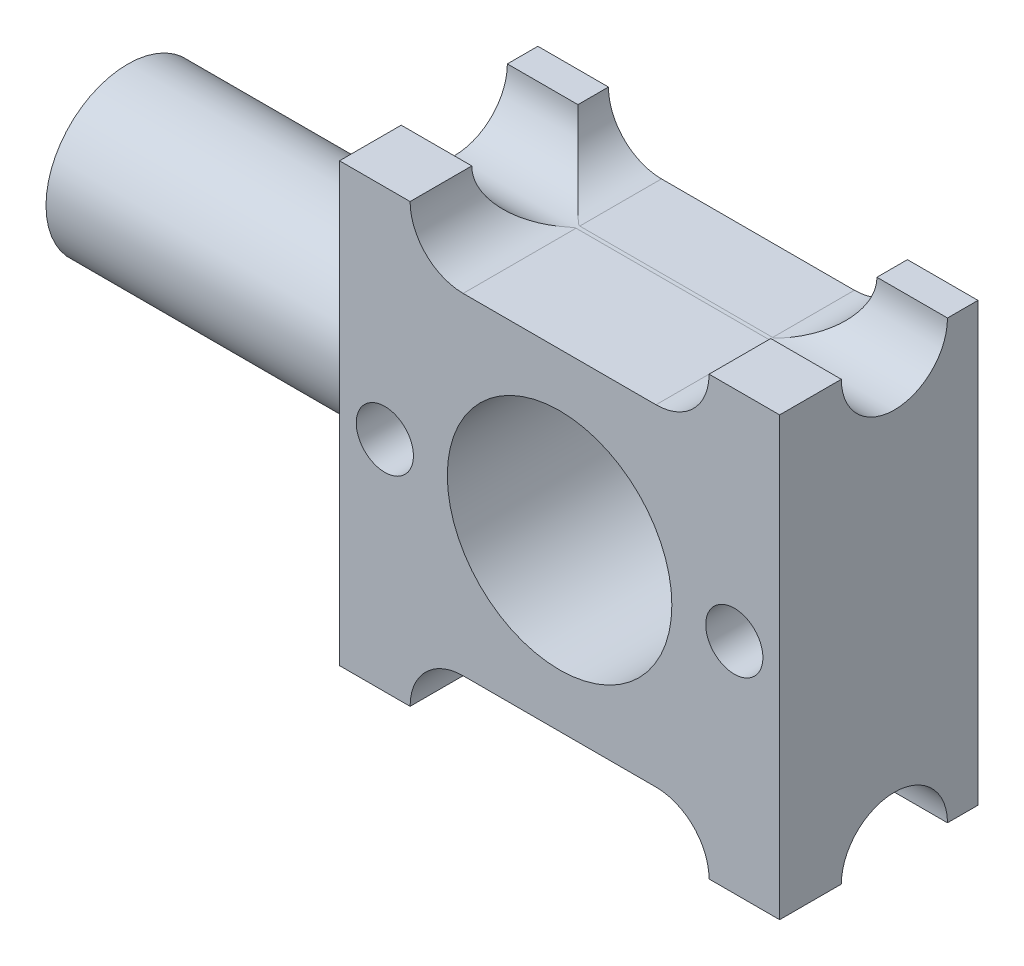
from build123d import *

# Parameters (mm, degrees)
SKETCH1_W           = 13.6906
SKETCH1_H           = 13.6
BOSS_EXTRUDE1_DEPTH = 6.17
SKETCH2_R           = 1.651
CUT_EXTRUDE1_DEPTH  = 17.484581534
SKETCH3_W           = 6
SKETCH3_H           = 1.65
CUT_EXTRUDE2_DEPTH  = 12.452817649
SKETCH4_R           = 3.4925
CUT_EXTRUDE3_DEPTH  = 12.452817822
SKETCH5_R           = 2.54
BOSS_EXTRUDE2_DEPTH = 10.16
SKETCH6_R           = 0.889
CUT_EXTRUDE4_DEPTH  = 20.325866881


with BuildPart() as part:
    # Sketch1 → Boss-Extrude1 (new body)
    with BuildSketch(Plane.XY):
        Rectangle(SKETCH1_W, SKETCH1_H)
    extrude(amount=BOSS_EXTRUDE1_DEPTH)

    # Sketch2 → Cut-Extrude1 (cut, through all)
    with BuildSketch(Plane(origin=(6.8453, 0, 0), x_dir=(0, 0, -1), z_dir=(1, 0, 0))):
        with Locations((-2.6, 6.8)):
            Circle(SKETCH2_R)
        with Locations((-2.6, -6.8)):
            Circle(SKETCH2_R)
    extrude(amount=-CUT_EXTRUDE1_DEPTH, mode=Mode.SUBTRACT)

    # Sketch3 → Cut-Extrude2 (cut, through all)
    with BuildSketch(Plane.XY.offset(6.17)):
        with BuildLine():
            Line((-3, 5.15), (-3, 6.8))
            Line((-3, 6.8), (-4.65, 6.8))
            ThreePointArc((-4.65, 6.8), (-4.166726189, 5.633273811), (-3, 5.15))
        make_face()
        with Locations((0, 5.975)):
            Rectangle(SKETCH3_W, SKETCH3_H)
        with BuildLine():
            Line((4.65, 6.8), (3, 6.8))
            Line((3, 6.8), (3, 5.15))
            ThreePointArc((3, 5.15), (4.166726189, 5.633273811), (4.65, 6.8))
        make_face()
        with BuildLine():
            Line((3, -5.15), (3, -6.8))
            Line((3, -6.8), (4.65, -6.8))
            ThreePointArc((4.65, -6.8), (4.166726189, -5.633273811), (3, -5.15))
        make_face()
        with Locations((0, -5.975)):
            Rectangle(SKETCH3_W, SKETCH3_H)
        with BuildLine():
            Line((-4.65, -6.8), (-3, -6.8))
            Line((-3, -6.8), (-3, -5.15))
            ThreePointArc((-3, -5.15), (-4.166726189, -5.633273811), (-4.65, -6.8))
        make_face()
    extrude(amount=-CUT_EXTRUDE2_DEPTH, mode=Mode.SUBTRACT)

    # Sketch4 → Cut-Extrude3 (cut, through all)
    with BuildSketch(Plane.XY.offset(6.17)):
        Circle(SKETCH4_R)
    extrude(amount=-CUT_EXTRUDE3_DEPTH, mode=Mode.SUBTRACT)

    # Sketch5 → Boss-Extrude2 (add)
    with BuildSketch(Plane.ZY.offset(6.8453)):
        with Locations(Location((2.6, 0, 0), (0, 0, 90))):
            Circle(SKETCH5_R)
    extrude(amount=BOSS_EXTRUDE2_DEPTH)

    # Sketch6 → Cut-Extrude4 (cut, through all)
    with BuildSketch(Plane.XY.offset(6.17)):
        with Locations((-5.4356, 0)):
            Circle(SKETCH6_R)
        with Locations(Location((5.4356, 0, 0), (0, 0, 180))):
            Circle(SKETCH6_R)
    extrude(amount=-CUT_EXTRUDE4_DEPTH, mode=Mode.SUBTRACT)


solid = part.part
